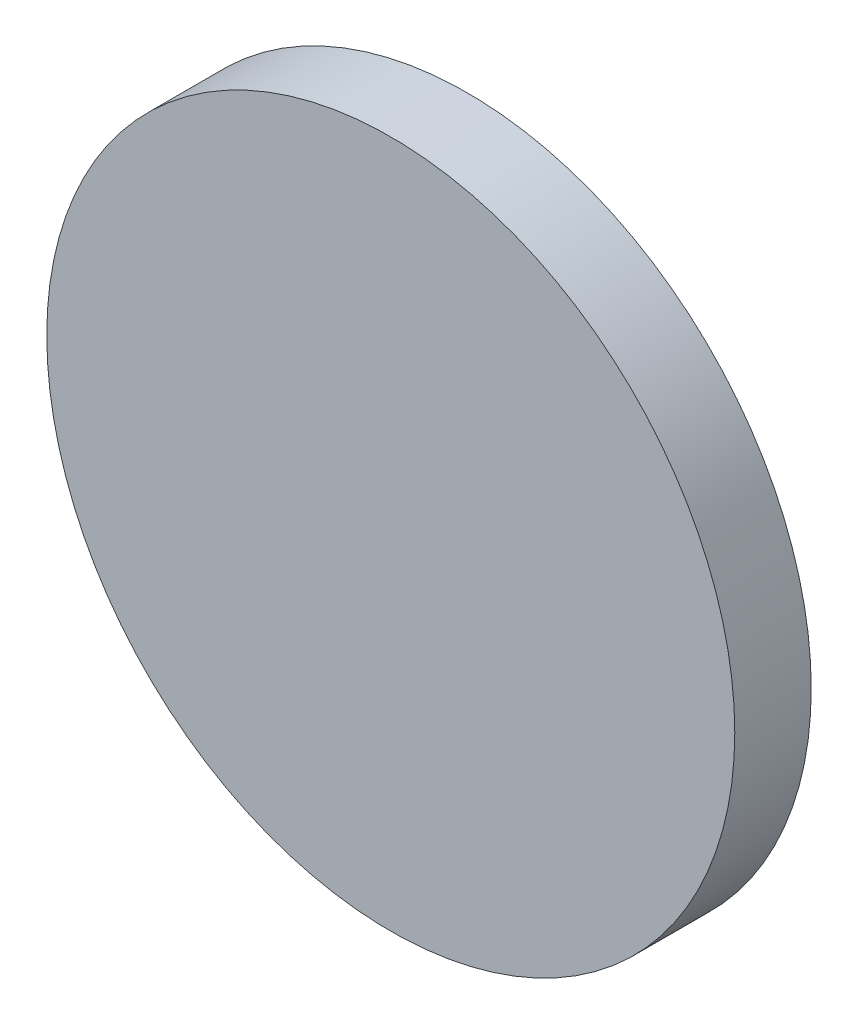
from build123d import *

# Parameters (mm, degrees)
SKETCH1_R           = 22.5
BOSS_EXTRUDE1_DEPTH = 5


with BuildPart() as part:
    # Sketch1 → Boss-Extrude1 (new body)
    with BuildSketch(Plane.XY):
        Circle(SKETCH1_R)
    extrude(amount=BOSS_EXTRUDE1_DEPTH)


solid = part.part
